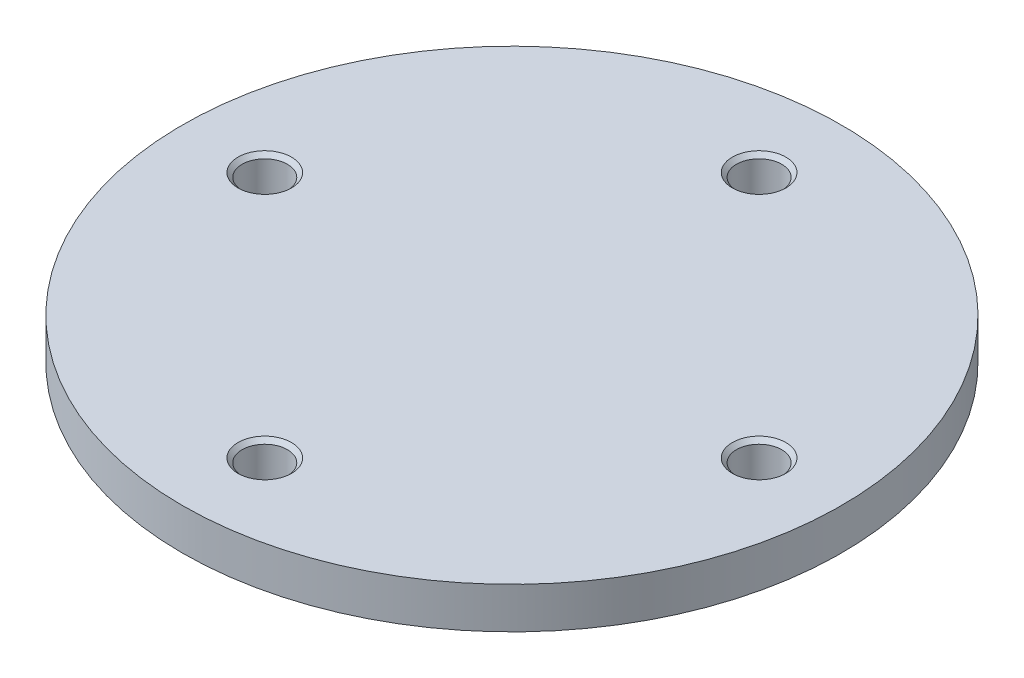
from build123d import *

# Parameters (mm, degrees)
SKETCH_1_R          = 10
EXTRUDE_1_DEPTH     = 21
SKETCH_2_R          = 40
EXTRUDE_2_DEPTH     = 5
CHAMFER_1_SIZE      = 10
SKETCH_3_R          = 2.75
CUT_EXTRUDE_2_DEPTH = 5
CHAMFER_2_SIZE      = 0.5
SKETCH_4_R          = 1.5
CUT_EXTRUDE_3_DEPTH = 63.257529665


with BuildPart() as part:
    # 草图1 → 凸台-拉伸1 (new body)
    with BuildSketch(Plane(origin=(0, 0, 0), x_dir=(1, 0, 0), z_dir=(0, 1, 0))):
        with Locations(Location((0, 0, 0), (0, 0, 90))):
            Circle(SKETCH_1_R)
        with BuildLine():
            Line((-1.734935157, 1.8), (1.734935157, 1.8))
            ThreePointArc((1.734935157, 1.8), (0, -2.5), (-1.734935157, 1.8))
        make_face(mode=Mode.SUBTRACT)
    extrude(amount=EXTRUDE_1_DEPTH)

    # 草图2 → 凸台-拉伸2 (add)
    with BuildSketch(Plane(origin=(0, 21, 0), x_dir=(1, 0, 0), z_dir=(0, 1, 0))):
        with Locations(Location((0, 0, 0), (0, 0, 270))):
            Circle(SKETCH_2_R)
    extrude(amount=EXTRUDE_2_DEPTH)

    # 倒角1
    chamfer_1_edges = [part.edges().sort_by_distance(p)[0] for p in [
        (0, 21, 10),
    ]]
    chamfer(chamfer_1_edges, length=CHAMFER_1_SIZE)

    # 草图3 → 切除-拉伸2 (cut)
    with BuildSketch(Plane(origin=(0, 26, 0), x_dir=(1, 0, 0), z_dir=(0, 1, 0))):
        with Locations(Location((0, 30, 0), (0, 0, 270))):
            Circle(SKETCH_3_R)
        with Locations(Location((30, 0, 0), (0, 0, 270))):
            Circle(SKETCH_3_R)
        with Locations(Location((0, -30, 0), (0, 0, 270))):
            Circle(SKETCH_3_R)
        with Locations(Location((-30, 0, 0), (0, 0, 270))):
            Circle(SKETCH_3_R)
    extrude(amount=-CUT_EXTRUDE_2_DEPTH, mode=Mode.SUBTRACT)

    # 倒角2
    chamfer_2_edges = [part.edges().sort_by_distance(p)[0] for p in [
        (0, 26, -32.75),
        (30, 26, -2.75),
        (0, 26, 27.25),
        (-30, 26, -2.75),
    ]]
    chamfer(chamfer_2_edges, length=CHAMFER_2_SIZE)

    # 草图4 → 切除-拉伸3 (cut, through all)
    with BuildSketch(Plane.XY):
        with Locations((0, 16.5)):
            Circle(SKETCH_4_R)
    extrude(amount=-CUT_EXTRUDE_3_DEPTH, mode=Mode.SUBTRACT)


solid = part.part
